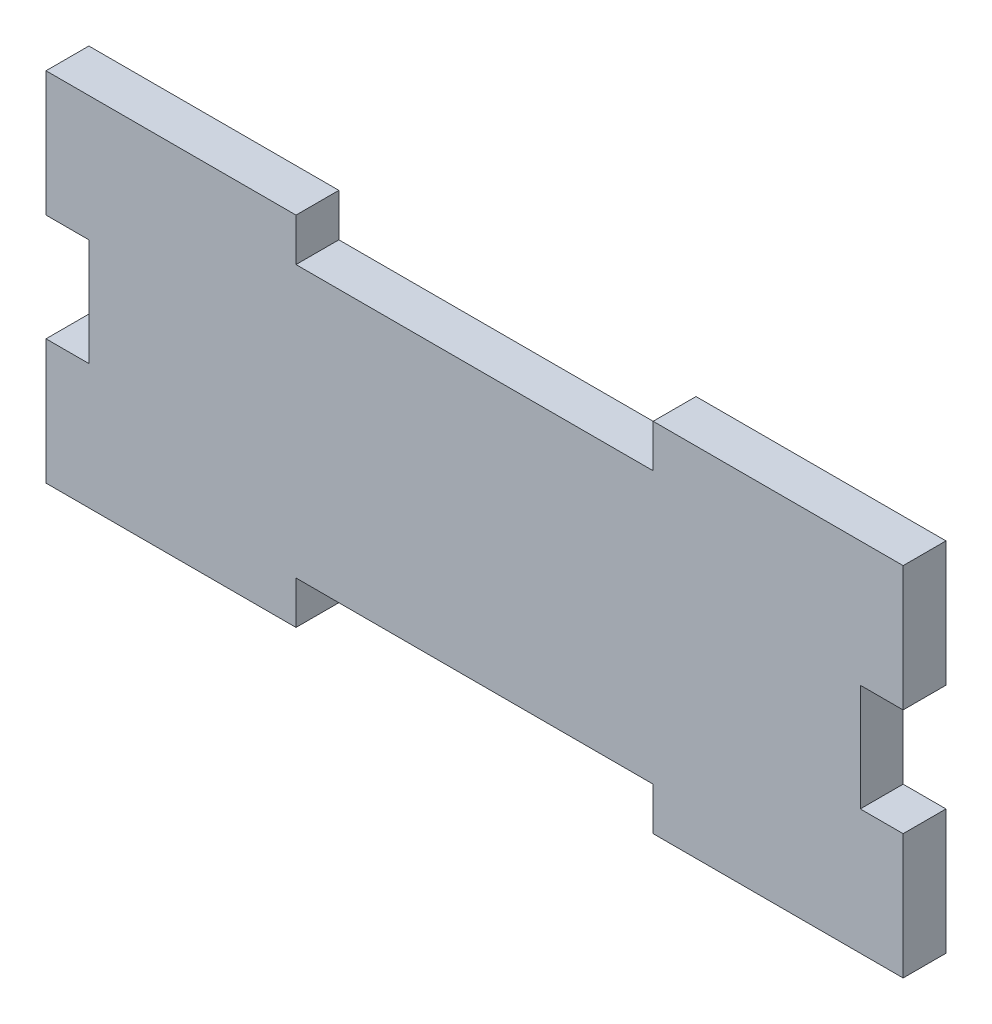
from build123d import *

# Parameters (mm, degrees)
SALIENTE_EXTRUIR1_DEPTH = 6


with BuildPart() as part:
    # Croquis1 → Saliente-Extruir1 (new body)
    with BuildSketch(Plane.XY):
        Polygon((-25, 19), (-25, 25), (-60, 25), (-60, 7.5), (-54, 7.5), (-54, -7.5), (-60, -7.5), (-60, -25), (-25, -25), (-25, -19), (25, -19), (25, -25), (60, -25), (60, -7.5), (54, -7.5), (54, 7.5), (60, 7.5), (60, 25), (25, 25), (25, 19), align=None)
    extrude(amount=SALIENTE_EXTRUIR1_DEPTH)


solid = part.part
